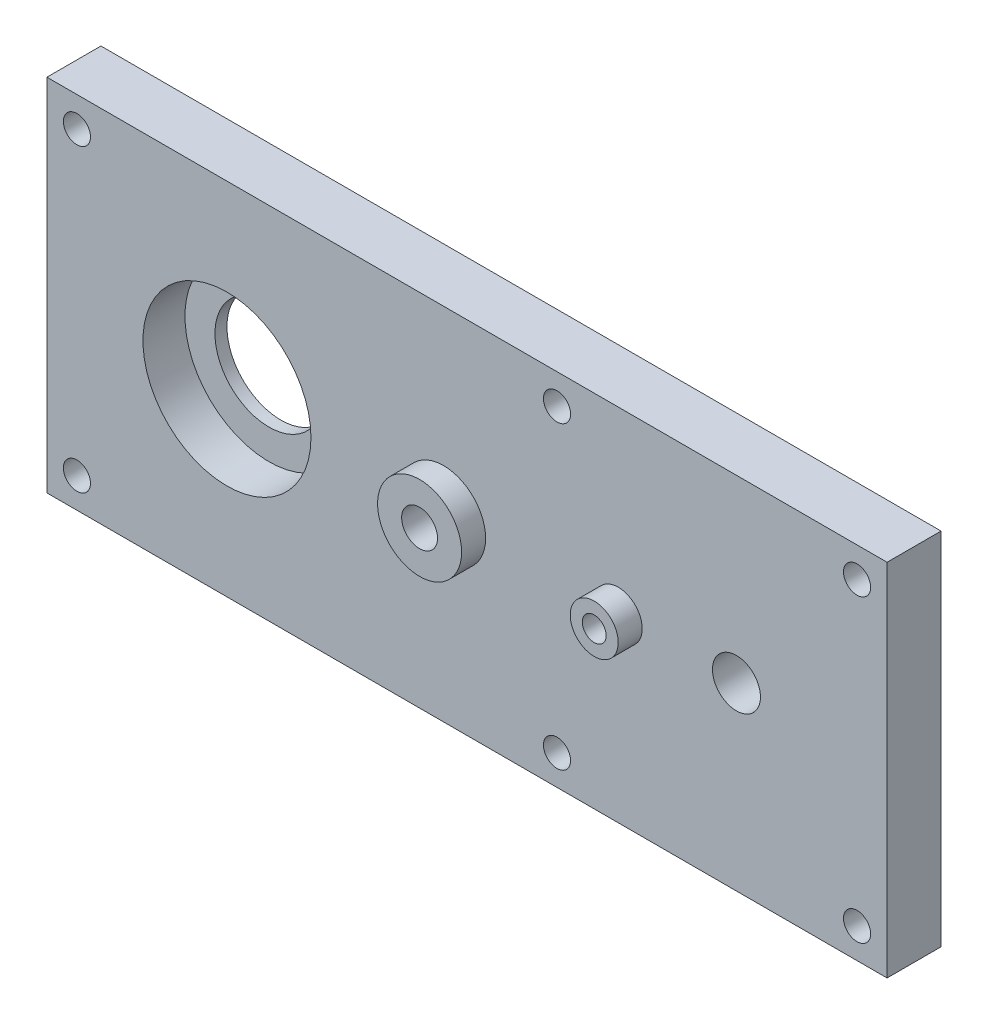
from build123d import *

# Parameters (mm, degrees)
SKETCH1_W             = 70
SKETCH1_H             = 30
SKETCH1_R             = 4.5
SKETCH1_R_2           = 1.495
SKETCH1_R_3           = 0.995
SKETCH1_R_4           = 2
BOSS_EXTRUDE1_DEPTH   = 4.5
F_2_CLEARANCE_HOLE1_D = 2.2606
SKETCH6_R             = 7
CUT_EXTRUDE1_DEPTH    = 3.5
SKETCH7_R             = 3.5
SKETCH7_R_2           = 1.495
BOSS_EXTRUDE2_DEPTH   = 2
SKETCH8_R             = 2
SKETCH8_R_2           = 0.995
BOSS_EXTRUDE3_DEPTH   = 2


with BuildPart() as part:
    # Sketch1 → Boss-Extrude1 (new body)
    with BuildSketch(Plane.XY):
        with Locations((20, 0)):
            Rectangle(SKETCH1_W, SKETCH1_H)
        Circle(SKETCH1_R, mode=Mode.SUBTRACT)
        with Locations((18.05, 0)):
            Circle(SKETCH1_R_2, mode=Mode.SUBTRACT)
        with Locations((32.6, 0)):
            Circle(SKETCH1_R_3, mode=Mode.SUBTRACT)
        with Locations((42.449999958, 0)):
            Circle(SKETCH1_R_4, mode=Mode.SUBTRACT)
    extrude(amount=BOSS_EXTRUDE1_DEPTH)

    # #2 Clearance Hole1 (through all)
    with Locations(Plane.XY.offset(4.5)):
        with Locations((-12.5, 12.5), (-12.5, -12.5), (27.5, 12.5), (27.5, -12.5), (52.5, 12.5), (52.5, -12.5)):
            Hole(F_2_CLEARANCE_HOLE1_D / 2)

    # Sketch6 → Cut-Extrude1 (cut)
    with BuildSketch(Plane.XY.offset(4.5)):
        Circle(SKETCH6_R)
    extrude(amount=-CUT_EXTRUDE1_DEPTH, mode=Mode.SUBTRACT)

    # Sketch7 → Boss-Extrude2 (add)
    with BuildSketch(Plane.XY.offset(4.5)):
        with Locations((18.05, 0)):
            Circle(SKETCH7_R)
        with Locations((18.05, 0)):
            Circle(SKETCH7_R_2, mode=Mode.SUBTRACT)
    extrude(amount=BOSS_EXTRUDE2_DEPTH)

    # Sketch8 → Boss-Extrude3 (add)
    with BuildSketch(Plane.XY.offset(4.5)):
        with Locations((32.6, 0)):
            Circle(SKETCH8_R)
        with Locations((32.6, 0)):
            Circle(SKETCH8_R_2, mode=Mode.SUBTRACT)
    extrude(amount=BOSS_EXTRUDE3_DEPTH)


solid = part.part
